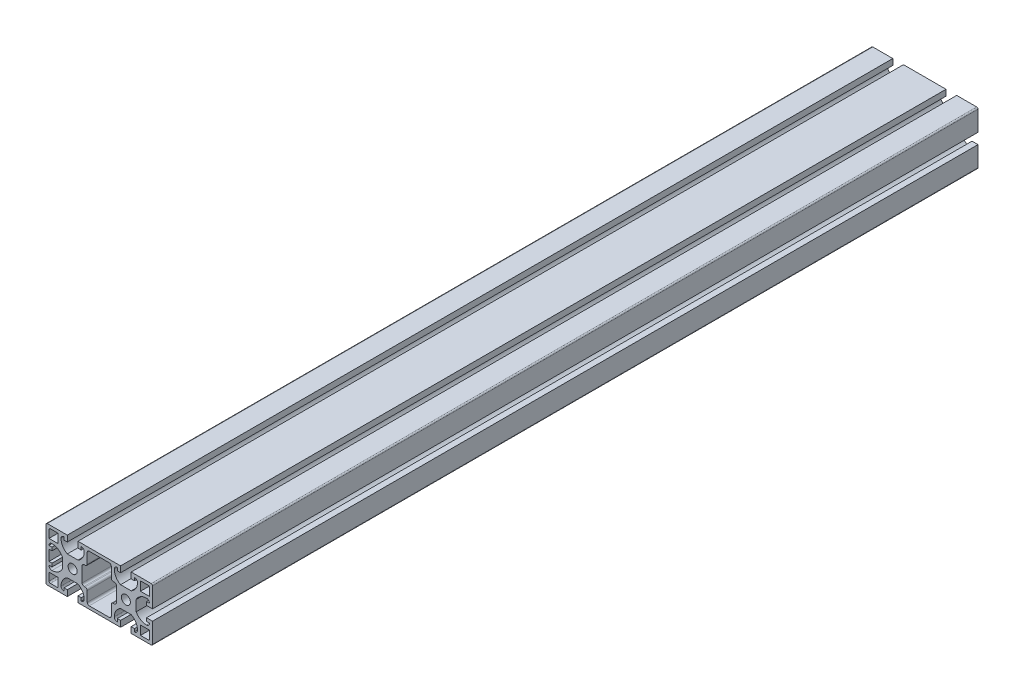
from build123d import *

# Parameters (mm, degrees)
SZKIC1_R                    = 3.4
DODANIE_WYCI_GNI_CIE1_DEPTH = 620


with BuildPart() as part:
    # Szkic1 → Dodanie-wyciągnięcie1 (new body)
    with BuildSketch(Plane.XY):
        with BuildLine():
            Line((-40, -19), (-40, 19))
            ThreePointArc((-40, 19), (-39.707106781, 19.707106781), (-39, 20))
            Line((-39, 20), (-24, 20))
            Line((-24, 20), (-24, 15.5))
            Line((-24, 15.5), (-26.471381771, 15.5))
            Line((-26.471381771, 15.5), (-26.471381771, 17.75))
            ThreePointArc((-26.471381771, 17.75), (-28.062372029, 17.090990258), (-28.721381771, 15.5))
            ThreePointArc((-28.721381771, 15.5), (-27.448087912, 10.962546258), (-24, 7.75))
            Line((-24, 7.75), (-16, 7.75))
            ThreePointArc((-16, 7.75), (-12.551912088, 10.962546258), (-11.278618229, 15.5))
            ThreePointArc((-11.278618229, 15.5), (-11.937627971, 17.090990258), (-13.528618229, 17.75))
            Line((-13.528618229, 17.75), (-13.528618229, 15.5))
            Line((-13.528618229, 15.5), (-16, 15.5))
            Line((-16, 15.5), (-16, 20))
            Line((-16, 20), (13.528618229, 20))
            Line((13.528618229, 20), (16, 20))
            Line((16, 20), (16, 15.5))
            Line((16, 15.5), (13.528618229, 15.5))
            Line((13.528618229, 15.5), (13.528618229, 17.75))
            ThreePointArc((13.528618229, 17.75), (11.937627971, 17.090990258), (11.278618229, 15.5))
            ThreePointArc((11.278618229, 15.5), (12.551912088, 10.962546258), (16, 7.75))
            Line((16, 7.75), (24, 7.75))
            ThreePointArc((24, 7.75), (27.448087912, 10.962546258), (28.721381771, 15.5))
            ThreePointArc((28.721381771, 15.5), (28.062372029, 17.090990258), (26.471381771, 17.75))
            Line((26.471381771, 17.75), (26.471381771, 15.5))
            Line((26.471381771, 15.5), (24, 15.5))
            Line((24, 15.5), (24, 20))
            Line((24, 20), (39, 20))
            ThreePointArc((39, 20), (39.707106781, 19.707106781), (40, 19))
            Line((40, 19), (40, 4))
            Line((40, 4), (35.5, 4))
            Line((35.5, 4), (35.5, 6.471381771))
            Line((35.5, 6.471381771), (37.75, 6.471381771))
            ThreePointArc((37.75, 6.471381771), (37.090990258, 8.062372029), (35.5, 8.721381771))
            ThreePointArc((35.5, 8.721381771), (30.962546258, 7.448087912), (27.75, 4))
            Line((27.75, 4), (27.75, -4))
            ThreePointArc((27.75, -4), (30.962546258, -7.448087912), (35.5, -8.721381771))
            ThreePointArc((35.5, -8.721381771), (37.090990258, -8.062372029), (37.75, -6.471381771))
            Line((37.75, -6.471381771), (35.5, -6.471381771))
            Line((35.5, -6.471381771), (35.5, -4))
            Line((35.5, -4), (40, -4))
            Line((40, -4), (40, -19))
            ThreePointArc((40, -19), (39.707106781, -19.707106781), (39, -20))
            Line((39, -20), (24, -20))
            Line((24, -20), (24, -15.5))
            Line((24, -15.5), (26.471381771, -15.5))
            Line((26.471381771, -15.5), (26.471381771, -17.75))
            ThreePointArc((26.471381771, -17.75), (28.062372029, -17.090990258), (28.721381771, -15.5))
            ThreePointArc((28.721381771, -15.5), (27.448087912, -10.962546258), (24, -7.75))
            Line((24, -7.75), (16, -7.75))
            ThreePointArc((16, -7.75), (12.551912088, -10.962546258), (11.278618229, -15.5))
            ThreePointArc((11.278618229, -15.5), (11.937627971, -17.090990258), (13.528618229, -17.75))
            Line((13.528618229, -17.75), (13.528618229, -15.5))
            Line((13.528618229, -15.5), (16, -15.5))
            Line((16, -15.5), (16, -20))
            Line((16, -20), (-16, -20))
            Line((-16, -20), (-16, -15.5))
            Line((-16, -15.5), (-13.528618229, -15.5))
            Line((-13.528618229, -15.5), (-13.528618229, -17.75))
            ThreePointArc((-13.528618229, -17.75), (-11.937627971, -17.090990258), (-11.278618229, -15.5))
            ThreePointArc((-11.278618229, -15.5), (-12.551912088, -10.962546258), (-16, -7.75))
            Line((-16, -7.75), (-24, -7.75))
            ThreePointArc((-24, -7.75), (-27.448087912, -10.962546258), (-28.721381771, -15.5))
            ThreePointArc((-28.721381771, -15.5), (-28.062372029, -17.090990258), (-26.471381771, -17.75))
            Line((-26.471381771, -17.75), (-26.471381771, -15.5))
            Line((-26.471381771, -15.5), (-24, -15.5))
            Line((-24, -15.5), (-24, -20))
            Line((-24, -20), (-39, -20))
            ThreePointArc((-39, -20), (-39.707106781, -19.707106781), (-40, -19))
        make_face()
        with Locations((-20, 0)):
            Circle(SZKIC1_R, mode=Mode.SUBTRACT)
        with Locations((20, 0)):
            Circle(SZKIC1_R, mode=Mode.SUBTRACT)
        with BuildLine():
            Line((30.971381771, -17.75), (36.75, -17.75))
            ThreePointArc((36.75, -17.75), (37.457106781, -17.457106781), (37.75, -16.75))
            Line((37.75, -16.75), (37.75, -10.971381771))
            Line((37.75, -10.971381771), (30.971381771, -10.971381771))
            Line((30.971381771, -10.971381771), (30.971381771, -17.75))
        make_face(mode=Mode.SUBTRACT)
        with BuildLine():
            Line((-35.5, -6.471381771), (-37.75, -6.471381771))
            ThreePointArc((-37.75, -6.471381771), (-37.090990258, -8.062372029), (-35.5, -8.721381771))
            ThreePointArc((-35.5, -8.721381771), (-30.962546258, -7.448087912), (-27.75, -4))
            Line((-27.75, -4), (-27.75, 4))
            ThreePointArc((-27.75, 4), (-30.962546258, 7.448087912), (-35.5, 8.721381771))
            ThreePointArc((-35.5, 8.721381771), (-37.090990258, 8.062372029), (-37.75, 6.471381771))
            Line((-37.75, 6.471381771), (-35.5, 6.471381771))
            Line((-35.5, 6.471381771), (-35.5, 4))
            Line((-35.5, 4), (-37.75, 4))
            Line((-37.75, 4), (-37.75, -4))
            Line((-37.75, -4), (-35.5, -4))
            Line((-35.5, -4), (-35.5, -6.471381771))
        make_face(mode=Mode.SUBTRACT)
        with BuildLine():
            Line((10.528618229, 7.090188806), (11.40950808, 7.090188806))
            ThreePointArc((11.40950808, 7.090188806), (12.470168251, 6.650848977), (12.90950808, 5.590188806))
            Line((12.90950808, 5.590188806), (12.90950808, -5.590188806))
            ThreePointArc((12.90950808, -5.590188806), (12.470168251, -6.650848977), (11.40950808, -7.090188806))
            Line((11.40950808, -7.090188806), (10.528618229, -7.090188806))
            ThreePointArc((10.528618229, -7.090188806), (9.467958057, -7.529528634), (9.028618229, -8.590188806))
            Line((9.028618229, -8.590188806), (9.028618229, -16.25))
            ThreePointArc((9.028618229, -16.25), (8.589278401, -17.310660172), (7.528618229, -17.75))
            Line((7.528618229, -17.75), (-7.528618229, -17.75))
            ThreePointArc((-7.528618229, -17.75), (-8.589278401, -17.310660172), (-9.028618229, -16.25))
            Line((-9.028618229, -16.25), (-9.028618229, -8.590188806))
            ThreePointArc((-9.028618229, -8.590188806), (-9.467958057, -7.529528634), (-10.528618229, -7.090188806))
            Line((-10.528618229, -7.090188806), (-11.40950808, -7.090188806))
            ThreePointArc((-11.40950808, -7.090188806), (-12.470168251, -6.650848977), (-12.90950808, -5.590188806))
            Line((-12.90950808, -5.590188806), (-12.90950808, 5.590188806))
            ThreePointArc((-12.90950808, 5.590188806), (-12.470168251, 6.650848977), (-11.40950808, 7.090188806))
            Line((-11.40950808, 7.090188806), (-10.528618229, 7.090188806))
            ThreePointArc((-10.528618229, 7.090188806), (-9.467958057, 7.529528634), (-9.028618229, 8.590188806))
            Line((-9.028618229, 8.590188806), (-9.028618229, 16.25))
            ThreePointArc((-9.028618229, 16.25), (-8.589278401, 17.310660172), (-7.528618229, 17.75))
            Line((-7.528618229, 17.75), (7.528618229, 17.75))
            ThreePointArc((7.528618229, 17.75), (8.589278401, 17.310660172), (9.028618229, 16.25))
            Line((9.028618229, 16.25), (9.028618229, 8.590188806))
            ThreePointArc((9.028618229, 8.590188806), (9.467958057, 7.529528634), (10.528618229, 7.090188806))
        make_face(mode=Mode.SUBTRACT)
        with BuildLine():
            Line((30.971381771, 10.971381771), (37.75, 10.971381771))
            Line((37.75, 10.971381771), (37.75, 16.75))
            ThreePointArc((37.75, 16.75), (37.457106781, 17.457106781), (36.75, 17.75))
            Line((36.75, 17.75), (30.971381771, 17.75))
            Line((30.971381771, 17.75), (30.971381771, 10.971381771))
        make_face(mode=Mode.SUBTRACT)
        with BuildLine():
            Line((-30.971381771, -10.971381771), (-30.971381771, -17.75))
            Line((-30.971381771, -17.75), (-36.75, -17.75))
            ThreePointArc((-36.75, -17.75), (-37.457106781, -17.457106781), (-37.75, -16.75))
            Line((-37.75, -16.75), (-37.75, -10.971381771))
            Line((-37.75, -10.971381771), (-30.971381771, -10.971381771))
        make_face(mode=Mode.SUBTRACT)
        with BuildLine():
            Line((-30.971381771, 17.75), (-36.75, 17.75))
            ThreePointArc((-36.75, 17.75), (-37.457106781, 17.457106781), (-37.75, 16.75))
            Line((-37.75, 16.75), (-37.75, 10.971381771))
            Line((-37.75, 10.971381771), (-30.971381771, 10.971381771))
            Line((-30.971381771, 10.971381771), (-30.971381771, 17.75))
        make_face(mode=Mode.SUBTRACT)
    extrude(amount=DODANIE_WYCI_GNI_CIE1_DEPTH)


solid = part.part
